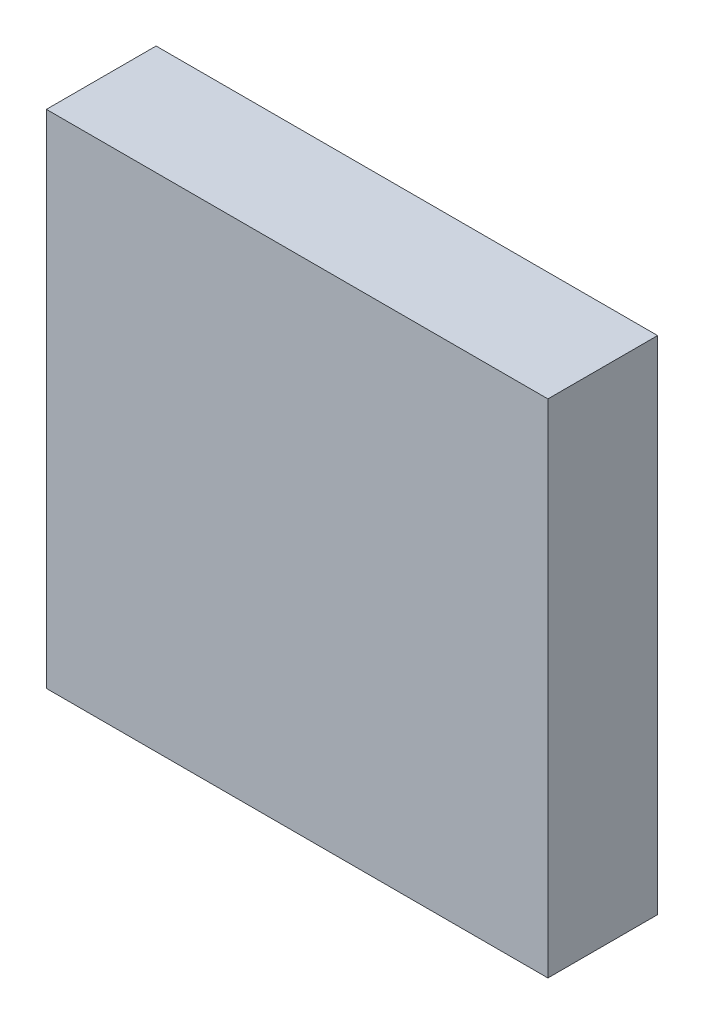
from build123d import *

# Parameters (mm, degrees)
SKETCH1_W           = 32
SKETCH1_H           = 32
BOSS_EXTRUDE1_DEPTH = 7


with BuildPart() as part:
    # Sketch1 → Boss-Extrude1 (new body)
    with BuildSketch(Plane.XY):
        Rectangle(SKETCH1_W, SKETCH1_H)
    extrude(amount=BOSS_EXTRUDE1_DEPTH)


solid = part.part
